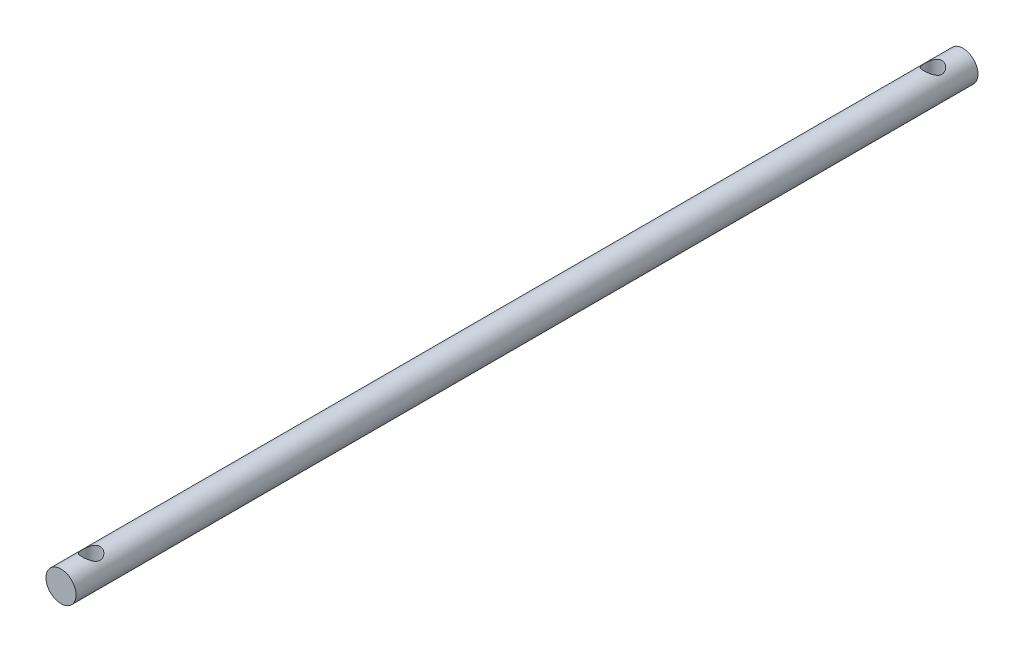
from build123d import *

# Parameters (mm, degrees)
SKETCH1_R           = 2.5
BOSS_EXTRUDE1_DEPTH = 150
SKETCH2_R           = 1.5
CUT_EXTRUDE1_DEPTH  = 15


with BuildPart() as part:
    # Sketch1 → Boss-Extrude1 (new body)
    with BuildSketch(Plane.XY):
        Circle(SKETCH1_R)
    extrude(amount=BOSS_EXTRUDE1_DEPTH)

    # Sketch2 → Cut-Extrude1 (cut, symmetric)
    with BuildSketch(Plane(origin=(0, 0, 0), x_dir=(1, 0, 0), z_dir=(0, 1, 0))):
        with Locations(Location((0, -5, 0), (0, 0, 270))):
            Circle(SKETCH2_R)
        with Locations(Location((0, -145, 0), (0, 0, 270))):
            Circle(SKETCH2_R)
    extrude(amount=CUT_EXTRUDE1_DEPTH, both=True, mode=Mode.SUBTRACT)


solid = part.part
